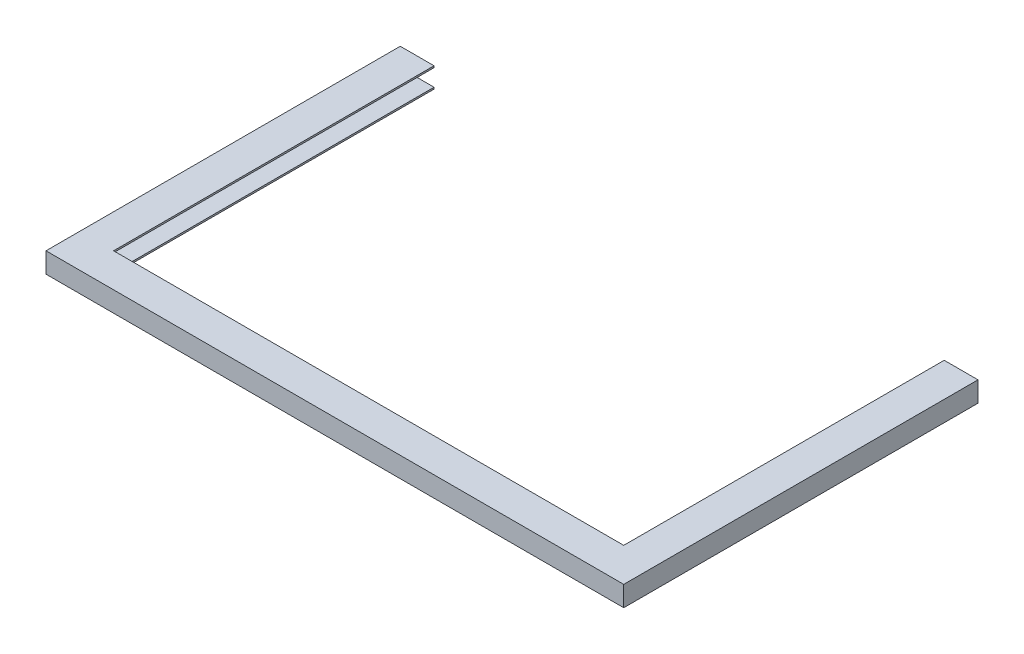
from build123d import *

# Parameters (mm, degrees)
SALIENTE_EXTRUIR2_DEPTH = 12
CROQUIS3_W              = 340
CROQUIS3_H              = 10
CORTAR_EXTRUIR1_DEPTH   = 208


with BuildPart() as part:
    # Croquis2 → Saliente-Extruir2 (new body)
    with BuildSketch(Plane(origin=(0, 0, 0), x_dir=(1, 0, 0), z_dir=(0, 1, 0))):
        Polygon((-171, -10), (171, -10), (171, 199.712394883), (151, 199.712394883), (151, 10), (-151, 10), (-151, 199.712394883), (-171, 199.712394883), align=None)
    extrude(amount=SALIENTE_EXTRUIR2_DEPTH)

    # Croquis3 → Cortar-Extruir1 (cut)
    with BuildSketch(Plane(origin=(0, 0, -199.712394883), x_dir=(-1, 0, 0), z_dir=(0, 0, -1))):
        with Locations((0, 6)):
            Rectangle(CROQUIS3_W, CROQUIS3_H)
    extrude(amount=-CORTAR_EXTRUIR1_DEPTH, mode=Mode.SUBTRACT)


solid = part.part
